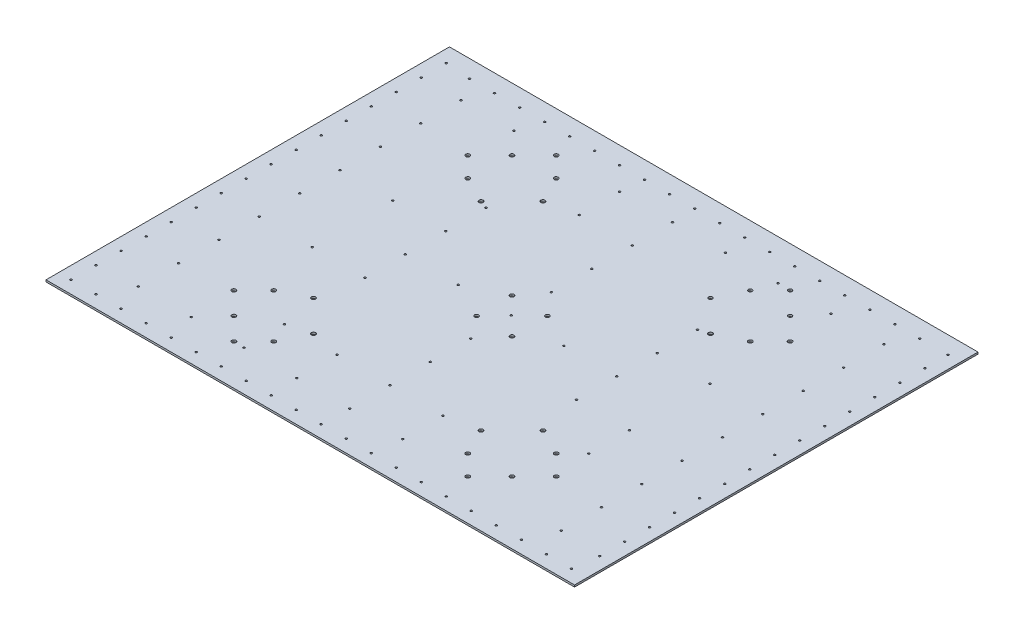
from build123d import *

# Parameters (mm, degrees)
SKETCH2_W           = 845
SKETCH2_H           = 645
SKETCH2_R           = 3.3
SKETCH2_R_2         = 3.25
SKETCH2_R_3         = 3
BOSS_EXTRUDE2_DEPTH = 3
SKETCH5_R           = 1.5
CUT_EXTRUDE1_DEPTH  = 10


with BuildPart() as part:
    # Sketch2 → Boss-Extrude2 (new body)
    with BuildSketch(Plane(origin=(0, 1310.548413309, 0), x_dir=(1, 0, 0), z_dir=(0, 1, 0))):
        with Locations((1065.777273447, -1504.227226955)):
            Rectangle(SKETCH2_W, SKETCH2_H)
        with Locations(Location((843.462901442, -1726.54159896, 0), (0, 0, 180))):
            Circle(SKETCH2_R, mode=Mode.SUBTRACT)
        with Locations(Location((878.818240502, -1761.896938019, 0), (0, 0, 180))):
            Circle(SKETCH2_R, mode=Mode.SUBTRACT)
        with Locations(Location((910.638045655, -1730.077132866, 0), (0, 0, 180))):
            Circle(SKETCH2_R, mode=Mode.SUBTRACT)
        with Locations(Location((808.107562383, -1691.186259901, 0), (0, 0, 180))):
            Circle(SKETCH2_R, mode=Mode.SUBTRACT)
        with Locations(Location((839.927367536, -1659.366454747, 0), (0, 0, 180))):
            Circle(SKETCH2_R, mode=Mode.SUBTRACT)
        with Locations(Location((931.851249091, -1687.650725995, 0), (0, 0, 180))):
            Circle(SKETCH2_R, mode=Mode.SUBTRACT)
        with Locations(Location((882.353774408, -1638.153251312, 0), (0, 0, 180))):
            Circle(SKETCH2_R, mode=Mode.SUBTRACT)
        with Locations(Location((1037.4930022, -1532.511498202, 0), (0, 0, 180))):
            Circle(SKETCH2_R_2, mode=Mode.SUBTRACT)
        with Locations(Location((1252.736306393, -1761.896938019, 0), (0, 0, 180))):
            Circle(SKETCH2_R, mode=Mode.SUBTRACT)
        with Locations(Location((1220.91650124, -1730.077132866, 0), (0, 0, 180))):
            Circle(SKETCH2_R, mode=Mode.SUBTRACT)
        with Locations(Location((1288.091645453, -1726.54159896, 0), (0, 0, 180))):
            Circle(SKETCH2_R, mode=Mode.SUBTRACT)
        with Locations(Location((1199.703297804, -1687.650725995, 0), (0, 0, 180))):
            Circle(SKETCH2_R, mode=Mode.SUBTRACT)
        with Locations(Location((1249.200772487, -1638.153251312, 0), (0, 0, 180))):
            Circle(SKETCH2_R, mode=Mode.SUBTRACT)
        with Locations(Location((1323.446984512, -1691.186259901, 0), (0, 0, 180))):
            Circle(SKETCH2_R, mode=Mode.SUBTRACT)
        with Locations(Location((1291.627179358, -1659.366454747, 0), (0, 0, 180))):
            Circle(SKETCH2_R, mode=Mode.SUBTRACT)
        with Locations(Location((1094.061544695, -1532.511498202, 0), (0, 0, 180))):
            Circle(SKETCH2_R_2, mode=Mode.SUBTRACT)
        with Locations(Location((1037.4930022, -1475.942955707, 0), (0, 0, 180))):
            Circle(SKETCH2_R_2, mode=Mode.SUBTRACT)
        with Locations(Location((839.927367536, -1349.087999163, 0), (0, 0, 180))):
            Circle(SKETCH2_R, mode=Mode.SUBTRACT)
        with Locations(Location((808.107562383, -1317.268194009, 0), (0, 0, 180))):
            Circle(SKETCH2_R, mode=Mode.SUBTRACT)
        with Locations(Location((882.353774408, -1370.301202598, 0), (0, 0, 180))):
            Circle(SKETCH2_R, mode=Mode.SUBTRACT)
        with Locations(Location((931.851249091, -1320.803727915, 0), (0, 0, 180))):
            Circle(SKETCH2_R, mode=Mode.SUBTRACT)
        with Locations(Location((843.462901442, -1281.91285495, 0), (0, 0, 180))):
            Circle(SKETCH2_R, mode=Mode.SUBTRACT)
        with Locations(Location((910.638045655, -1278.377321044, 0), (0, 0, 180))):
            Circle(SKETCH2_R, mode=Mode.SUBTRACT)
        with Locations(Location((878.818240502, -1246.55751589, 0), (0, 0, 180))):
            Circle(SKETCH2_R, mode=Mode.SUBTRACT)
        with Locations(Location((1094.061544695, -1475.942955707, 0), (0, 0, 180))):
            Circle(SKETCH2_R_2, mode=Mode.SUBTRACT)
        with Locations(Location((1249.200772487, -1370.301202598, 0), (0, 0, 180))):
            Circle(SKETCH2_R, mode=Mode.SUBTRACT)
        with Locations(Location((1291.627179359, -1349.087999162, 0), (0, 0, 180))):
            Circle(SKETCH2_R, mode=Mode.SUBTRACT)
        with Locations(Location((1323.446984512, -1317.268194009, 0), (0, 0, 180))):
            Circle(SKETCH2_R, mode=Mode.SUBTRACT)
        with Locations(Location((1220.91650124, -1278.377321044, 0), (0, 0, 180.000000001))):
            Circle(SKETCH2_R_3, mode=Mode.SUBTRACT)
        with Locations(Location((1252.736306393, -1246.55751589, 0), (0, 0, 180.000000001))):
            Circle(SKETCH2_R_3, mode=Mode.SUBTRACT)
        with Locations(Location((1288.091645453, -1281.91285495, 0), (0, 0, 180.000000001))):
            Circle(SKETCH2_R_3, mode=Mode.SUBTRACT)
        with Locations(Location((1199.703297804, -1320.803727915, 0), (0, 0, 180.000000001))):
            Circle(SKETCH2_R_3, mode=Mode.SUBTRACT)
    extrude(amount=BOSS_EXTRUDE2_DEPTH)

    # Sketch5 → Cut-Extrude1 (cut)
    with BuildSketch(Plane.XZ.offset(-1310.548413309)):
        with Locations((726.316894315, 1762.227226955)):
            Circle(SKETCH5_R)
        with Locations((810.816894315, 1762.227226955)):
            Circle(SKETCH5_R)
        with Locations((895.316894315, 1762.227226955)):
            Circle(SKETCH5_R)
        with Locations((979.816894315, 1762.227226955)):
            Circle(SKETCH5_R)
        with Locations((1064.316894315, 1762.227226955)):
            Circle(SKETCH5_R)
        with Locations((1148.816894315, 1762.227226955)):
            Circle(SKETCH5_R)
        with Locations((1402.316894315, 1762.227226955)):
            Circle(SKETCH5_R)
        with Locations((895.316894315, 1697.727226955)):
            Circle(SKETCH5_R)
        with Locations((979.816894315, 1697.727226955)):
            Circle(SKETCH5_R)
        with Locations((1064.316894315, 1697.727226955)):
            Circle(SKETCH5_R)
        with Locations((1148.816894315, 1697.727226955)):
            Circle(SKETCH5_R)
        with Locations((1402.316894315, 1697.727226955)):
            Circle(SKETCH5_R)
        with Locations((1064.316894315, 1633.227226955)):
            Circle(SKETCH5_R)
        with Locations((1317.816894315, 1633.227226955)):
            Circle(SKETCH5_R)
        with Locations((1402.316894315, 1633.227226955)):
            Circle(SKETCH5_R)
        with Locations((810.816894315, 1568.727226955)):
            Circle(SKETCH5_R)
        with Locations((895.316894315, 1568.727226955)):
            Circle(SKETCH5_R)
        with Locations((1064.316894315, 1568.727226955)):
            Circle(SKETCH5_R)
        with Locations((1233.316894315, 1568.727226955)):
            Circle(SKETCH5_R)
        with Locations((1317.816894315, 1568.727226955)):
            Circle(SKETCH5_R)
        with Locations((1402.316894315, 1568.727226955)):
            Circle(SKETCH5_R)
        with Locations((895.316894315, 1504.227226955)):
            Circle(SKETCH5_R)
        with Locations((979.816894315, 1504.227226955)):
            Circle(SKETCH5_R)
        with Locations((1064.316894315, 1504.227226955)):
            Circle(SKETCH5_R)
        with Locations((1148.816894315, 1504.227226955)):
            Circle(SKETCH5_R)
        with Locations((1233.316894315, 1504.227226955)):
            Circle(SKETCH5_R)
        with Locations((1402.316894315, 1504.227226955)):
            Circle(SKETCH5_R)
        with Locations((810.816894315, 1439.727226955)):
            Circle(SKETCH5_R)
        with Locations((895.316894315, 1439.727226955)):
            Circle(SKETCH5_R)
        with Locations((1064.316894315, 1439.727226955)):
            Circle(SKETCH5_R)
        with Locations((1233.316894315, 1439.727226955)):
            Circle(SKETCH5_R)
        with Locations((1317.816894315, 1439.727226955)):
            Circle(SKETCH5_R)
        with Locations((1402.316894315, 1439.727226955)):
            Circle(SKETCH5_R)
        with Locations((895.316894315, 1375.227226955)):
            Circle(SKETCH5_R)
        with Locations((1064.316894315, 1375.227226955)):
            Circle(SKETCH5_R)
        with Locations((1233.316894315, 1375.227226955)):
            Circle(SKETCH5_R)
        with Locations((1402.316894315, 1375.227226955)):
            Circle(SKETCH5_R)
        with Locations((979.816894315, 1310.727226955)):
            Circle(SKETCH5_R)
        with Locations((1064.316894315, 1310.727226955)):
            Circle(SKETCH5_R)
        with Locations((1402.316894315, 1310.727226955)):
            Circle(SKETCH5_R)
        with Locations((810.816894315, 1246.227226955)):
            Circle(SKETCH5_R)
        with Locations((979.816894315, 1246.227226955)):
            Circle(SKETCH5_R)
        with Locations((1064.316894315, 1246.227226955)):
            Circle(SKETCH5_R)
        with Locations((1148.816894315, 1246.227226955)):
            Circle(SKETCH5_R)
        with Locations((1233.316894315, 1246.227226955)):
            Circle(SKETCH5_R)
        with Locations((1317.816894315, 1246.227226955)):
            Circle(SKETCH5_R)
        with Locations((1402.316894315, 1246.227226955)):
            Circle(SKETCH5_R)
        with Locations((726.316894315, 1697.727226955)):
            Circle(SKETCH5_R)
        with Locations((726.316894315, 1633.227226955)):
            Circle(SKETCH5_R)
        with Locations((726.316894315, 1568.727226955)):
            Circle(SKETCH5_R)
        with Locations((726.316894315, 1504.227226955)):
            Circle(SKETCH5_R)
        with Locations((726.316894315, 1439.727226955)):
            Circle(SKETCH5_R)
        with Locations((726.316894315, 1375.227226955)):
            Circle(SKETCH5_R)
        with Locations((726.316894315, 1310.727226955)):
            Circle(SKETCH5_R)
        with Locations((726.316894315, 1246.227226955)):
            Circle(SKETCH5_R)
        with Locations((663.277273447, 1806.727226955)):
            Circle(SKETCH5_R)
        with Locations((703.277273447, 1806.727226955)):
            Circle(SKETCH5_R)
        with Locations((743.277273447, 1806.727226955)):
            Circle(SKETCH5_R)
        with Locations((783.277273447, 1806.727226955)):
            Circle(SKETCH5_R)
        with Locations((823.277273447, 1806.727226955)):
            Circle(SKETCH5_R)
        with Locations((863.277273447, 1806.727226955)):
            Circle(SKETCH5_R)
        with Locations((903.277273447, 1806.727226955)):
            Circle(SKETCH5_R)
        with Locations((943.277273447, 1806.727226955)):
            Circle(SKETCH5_R)
        with Locations((983.277273447, 1806.727226955)):
            Circle(SKETCH5_R)
        with Locations((1023.277273447, 1806.727226955)):
            Circle(SKETCH5_R)
        with Locations((1063.277273447, 1806.727226955)):
            Circle(SKETCH5_R)
        with Locations((1103.277273447, 1806.727226955)):
            Circle(SKETCH5_R)
        with Locations((1143.277273447, 1806.727226955)):
            Circle(SKETCH5_R)
        with Locations((1183.277273447, 1806.727226955)):
            Circle(SKETCH5_R)
        with Locations((1223.277273447, 1806.727226955)):
            Circle(SKETCH5_R)
        with Locations((1263.277273447, 1806.727226955)):
            Circle(SKETCH5_R)
        with Locations((1303.277273447, 1806.727226955)):
            Circle(SKETCH5_R)
        with Locations((1343.277273447, 1806.727226955)):
            Circle(SKETCH5_R)
        with Locations((1383.277273447, 1806.727226955)):
            Circle(SKETCH5_R)
        with Locations((1423.277273447, 1806.727226955)):
            Circle(SKETCH5_R)
        with Locations((1463.277273447, 1806.727226955)):
            Circle(SKETCH5_R)
        with Locations((663.277273447, 1766.727226955)):
            Circle(SKETCH5_R)
        with Locations((663.277273447, 1726.727226955)):
            Circle(SKETCH5_R)
        with Locations((663.277273447, 1686.727226955)):
            Circle(SKETCH5_R)
        with Locations((663.277273447, 1646.727226955)):
            Circle(SKETCH5_R)
        with Locations((663.277273447, 1606.727226955)):
            Circle(SKETCH5_R)
        with Locations((663.277273447, 1566.727226955)):
            Circle(SKETCH5_R)
        with Locations((663.277273447, 1526.727226955)):
            Circle(SKETCH5_R)
        with Locations((663.277273447, 1486.727226955)):
            Circle(SKETCH5_R)
        with Locations((663.277273447, 1446.727226955)):
            Circle(SKETCH5_R)
        with Locations((663.277273447, 1406.727226955)):
            Circle(SKETCH5_R)
        with Locations((663.277273447, 1366.727226955)):
            Circle(SKETCH5_R)
        with Locations((663.277273447, 1326.727226955)):
            Circle(SKETCH5_R)
        with Locations((663.277273447, 1286.727226955)):
            Circle(SKETCH5_R)
        with Locations((663.277273447, 1246.727226955)):
            Circle(SKETCH5_R)
        with Locations((663.277273447, 1206.727226955)):
            Circle(SKETCH5_R)
        with Locations(Location((1468.277273447, 1246.727226955, 0), (0, 0, 180))):
            Circle(SKETCH5_R)
        with Locations(Location((1468.277273447, 1286.727226955, 0), (0, 0, 180))):
            Circle(SKETCH5_R)
        with Locations(Location((1468.277273447, 1326.727226955, 0), (0, 0, 180))):
            Circle(SKETCH5_R)
        with Locations(Location((1468.277273447, 1366.727226955, 0), (0, 0, 180))):
            Circle(SKETCH5_R)
        with Locations(Location((1468.277273447, 1406.727226955, 0), (0, 0, 180))):
            Circle(SKETCH5_R)
        with Locations(Location((1468.277273447, 1446.727226955, 0), (0, 0, 180))):
            Circle(SKETCH5_R)
        with Locations(Location((1468.277273447, 1486.727226955, 0), (0, 0, 180))):
            Circle(SKETCH5_R)
        with Locations(Location((1468.277273447, 1526.727226955, 0), (0, 0, 180))):
            Circle(SKETCH5_R)
        with Locations(Location((1468.277273447, 1566.727226955, 0), (0, 0, 180))):
            Circle(SKETCH5_R)
        with Locations(Location((1468.277273447, 1606.727226955, 0), (0, 0, 180))):
            Circle(SKETCH5_R)
        with Locations(Location((1468.277273447, 1646.727226955, 0), (0, 0, 180))):
            Circle(SKETCH5_R)
        with Locations(Location((1468.277273447, 1686.727226955, 0), (0, 0, 180))):
            Circle(SKETCH5_R)
        with Locations(Location((1468.277273447, 1726.727226955, 0), (0, 0, 180))):
            Circle(SKETCH5_R)
        with Locations(Location((1468.277273447, 1766.727226955, 0), (0, 0, 180))):
            Circle(SKETCH5_R)
        with Locations((1468.277273447, 1209.677220955)):
            Circle(SKETCH5_R)
        with Locations(Location((1423.277273447, 1209.677220955, 0), (0, 0, 180))):
            Circle(SKETCH5_R)
        with Locations(Location((1383.277273447, 1209.677220955, 0), (0, 0, 180))):
            Circle(SKETCH5_R)
        with Locations(Location((1343.277273447, 1209.677220955, 0), (0, 0, 180))):
            Circle(SKETCH5_R)
        with Locations(Location((1303.277273447, 1209.677220955, 0), (0, 0, 180))):
            Circle(SKETCH5_R)
        with Locations(Location((1263.277273447, 1209.677220955, 0), (0, 0, 180))):
            Circle(SKETCH5_R)
        with Locations(Location((1223.277273447, 1209.677220955, 0), (0, 0, 180))):
            Circle(SKETCH5_R)
        with Locations(Location((1183.277273447, 1209.677220955, 0), (0, 0, 180))):
            Circle(SKETCH5_R)
        with Locations(Location((1143.277273447, 1209.677220955, 0), (0, 0, 180))):
            Circle(SKETCH5_R)
        with Locations(Location((1103.277273447, 1209.677220955, 0), (0, 0, 180))):
            Circle(SKETCH5_R)
        with Locations(Location((1063.277273447, 1209.677220955, 0), (0, 0, 180))):
            Circle(SKETCH5_R)
        with Locations(Location((1023.277273447, 1209.677220955, 0), (0, 0, 180))):
            Circle(SKETCH5_R)
        with Locations(Location((983.277273447, 1209.677220955, 0), (0, 0, 180))):
            Circle(SKETCH5_R)
        with Locations(Location((943.277273447, 1209.677220955, 0), (0, 0, 180))):
            Circle(SKETCH5_R)
        with Locations(Location((903.277273447, 1209.677220955, 0), (0, 0, 180))):
            Circle(SKETCH5_R)
        with Locations(Location((863.277273447, 1209.677220955, 0), (0, 0, 180))):
            Circle(SKETCH5_R)
        with Locations(Location((823.277273447, 1209.677220955, 0), (0, 0, 180))):
            Circle(SKETCH5_R)
        with Locations(Location((783.277273447, 1209.677220955, 0), (0, 0, 180))):
            Circle(SKETCH5_R)
        with Locations(Location((743.277273447, 1209.677220955, 0), (0, 0, 180))):
            Circle(SKETCH5_R)
        with Locations(Location((703.277273447, 1209.677220955, 0), (0, 0, 180))):
            Circle(SKETCH5_R)
    extrude(amount=-CUT_EXTRUDE1_DEPTH, mode=Mode.SUBTRACT)


solid = part.part
